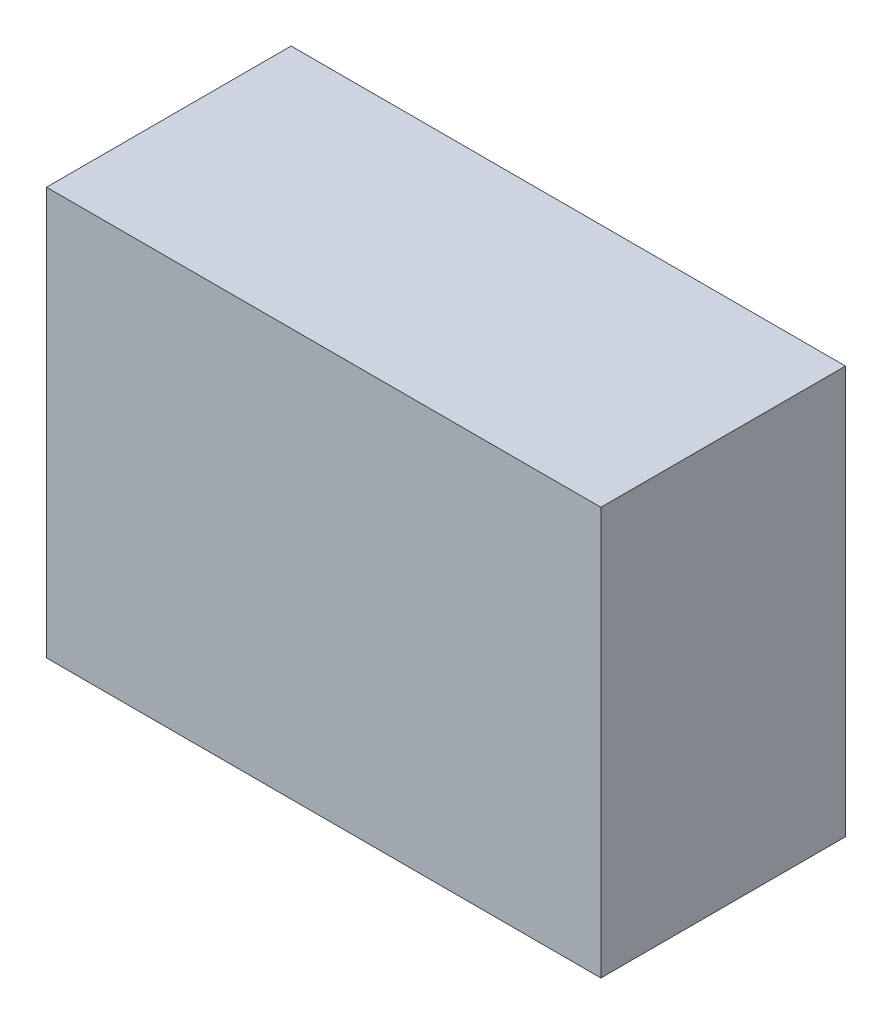
from build123d import *

# Parameters (mm, degrees)
SKETCH1_W           = 172.72
SKETCH1_H           = 127
BOSS_EXTRUDE1_DEPTH = 76.2


with BuildPart() as part:
    # Sketch1 → Boss-Extrude1 (new body)
    with BuildSketch(Plane.XY):
        Rectangle(SKETCH1_W, SKETCH1_H)
    extrude(amount=BOSS_EXTRUDE1_DEPTH)


solid = part.part
